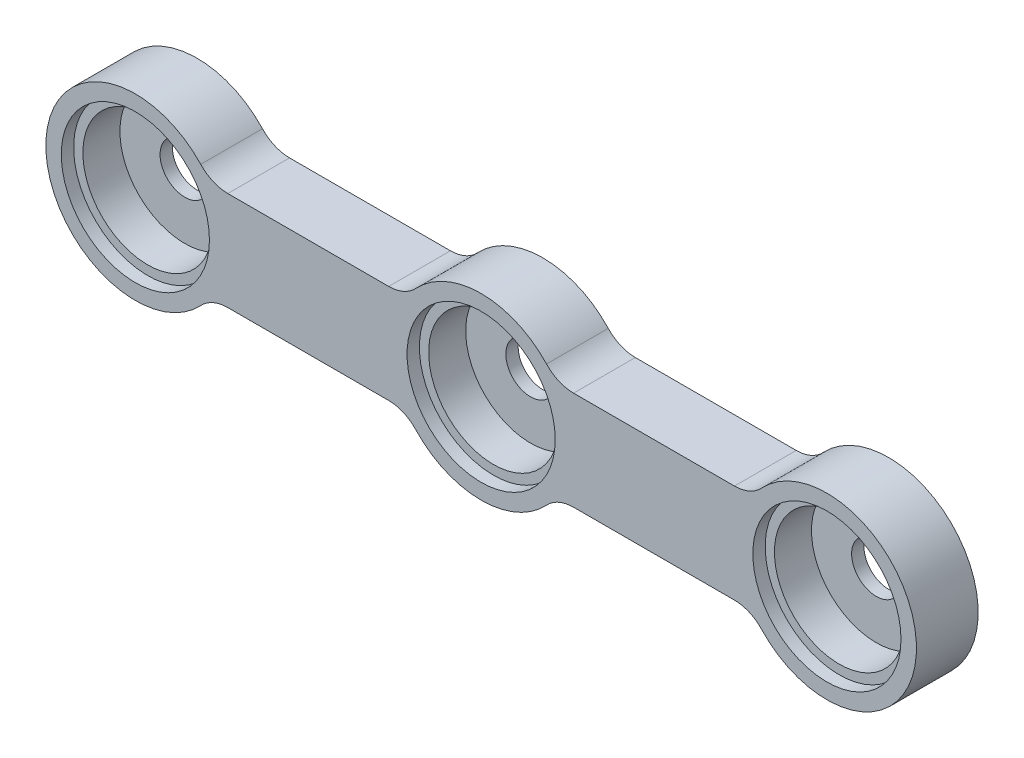
from build123d import *

# Parameters (mm, degrees)
BOSS_EXTRUDE1_DEPTH = 5
SKETCH2_R           = 7.25
BOSS_EXTRUDE2_DEPTH = 5
SKETCH5_R           = 6
CUT_EXTRUDE2_DEPTH  = 1
SKETCH6_R           = 2
CUT_EXTRUDE3_DEPTH  = 4
FILLET1_R           = 3
SKETCH7_R           = 5.25
CUT_EXTRUDE4_DEPTH  = 3


with BuildPart() as part:
    # Sketch1 → Boss-Extrude1 (new body)
    with BuildSketch(Plane.XY):
        with BuildLine():
            Line((-68.758315939, 4), (-12.748315939, 4))
            ThreePointArc((-12.748315939, 4), (-8.748315939, 0), (-12.748315939, -4))
            Line((-12.748315939, -4), (-68.758315939, -4))
            ThreePointArc((-68.758315939, -4), (-72.758315939, 0), (-68.758315939, 4))
        make_face()
    extrude(amount=BOSS_EXTRUDE1_DEPTH)

    # Sketch2 → Boss-Extrude2 (add)
    with BuildSketch(Plane(origin=(0, 0, 0), x_dir=(-1, 0, 0), z_dir=(0, 0, -1))):
        with Locations((40.753315939, 0)):
            Circle(SKETCH2_R)
        with Locations((68.758315939, 0)):
            Circle(SKETCH2_R)
        with Locations((12.748315939, 0)):
            Circle(SKETCH2_R)
    extrude(amount=-BOSS_EXTRUDE2_DEPTH)

    # Sketch5 → Cut-Extrude2 (cut)
    with BuildSketch(Plane.XY.offset(5)):
        with Locations((-68.758315939, 0)):
            Circle(SKETCH5_R)
        with Locations((-40.753315939, 0)):
            Circle(SKETCH5_R)
        with Locations((-12.748315939, 0)):
            Circle(SKETCH5_R)
    extrude(amount=-CUT_EXTRUDE2_DEPTH, mode=Mode.SUBTRACT)

    # Sketch6 → Cut-Extrude3 (cut)
    with BuildSketch(Plane(origin=(0, 0, 0), x_dir=(-1, 0, 0), z_dir=(0, 0, -1))):
        with Locations((12.748315939, 0)):
            Circle(SKETCH6_R)
        with Locations((40.753315939, 0)):
            Circle(SKETCH6_R)
        with Locations(Location((68.758315939, 0, 0), (0, 0, 180))):
            Circle(SKETCH6_R)
    extrude(amount=-CUT_EXTRUDE3_DEPTH, mode=Mode.SUBTRACT)

    # Fillet1
    fillet1_edges = [part.edges().sort_by_distance(p)[0] for p in [
        (-34.706622628, -4, 2.5),
        (-34.706622628, 4, 2.5),
        (-46.80000925, -4, 2.5),
        (-46.80000925, 4, 2.5),
        (-62.711622628, 4, 2.5),
        (-62.711622628, -4, 2.5),
        (-18.79500925, -4, 2.5),
        (-18.79500925, 4, 2.5),
    ]]
    fillet(fillet1_edges, radius=FILLET1_R)

    # Sketch7 → Cut-Extrude4 (cut)
    with BuildSketch(Plane.XY.offset(4)):
        with Locations((-68.758315939, 0)):
            Circle(SKETCH7_R)
        with Locations((-40.753315939, 0)):
            Circle(SKETCH7_R)
        with Locations((-12.748315939, 0)):
            Circle(SKETCH7_R)
    extrude(amount=-CUT_EXTRUDE4_DEPTH, mode=Mode.SUBTRACT)


solid = part.part
